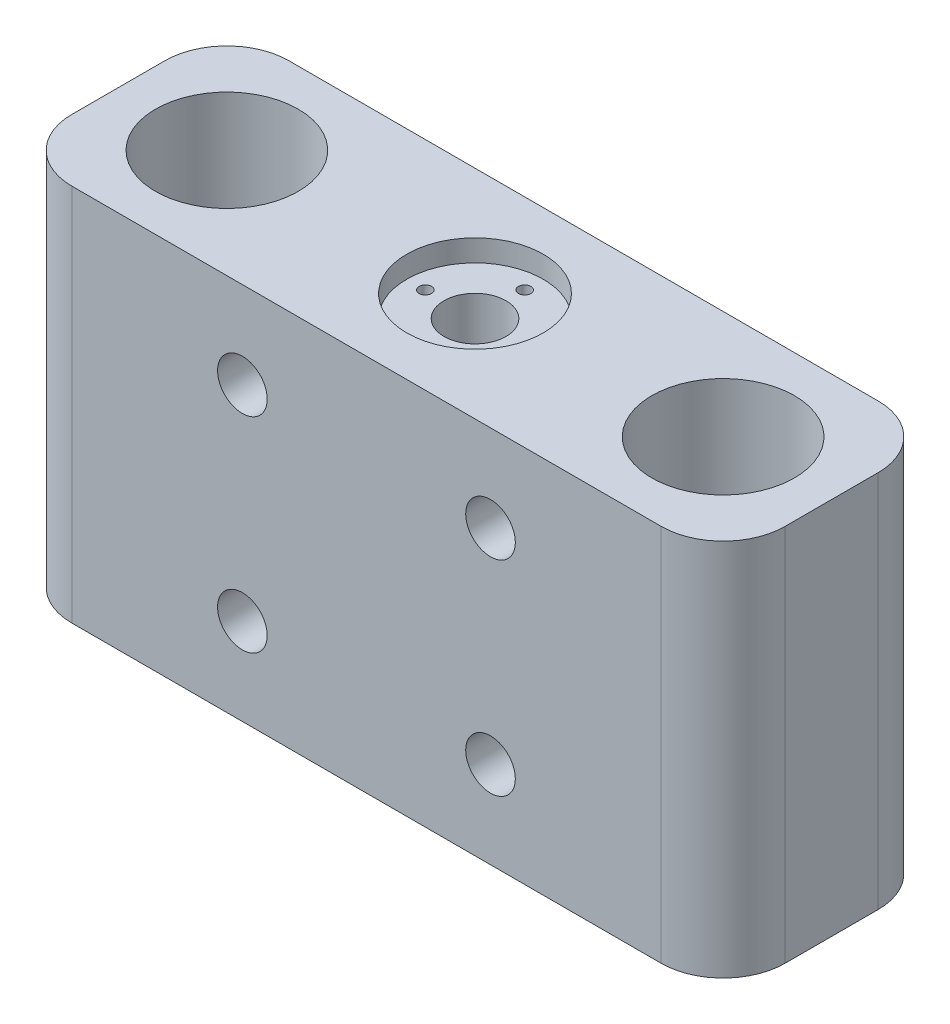
from build123d import *

# Parameters (mm, degrees)
SKETCH1_R           = 11.5
SKETCH1_R_2         = 5
BOSS_EXTRUDE1_DEPTH = 61
SKETCH2_R           = 11
SKETCH2_R_2         = 1
CUT_EXTRUDE1_DEPTH  = 3.5
SKETCH2_2_R         = 1
CUT_EXTRUDE2_DEPTH  = 13.5
SKETCH4_R           = 4
CUT_EXTRUDE3_DEPTH  = 135.799851632
CUT_EXTRUDE4_START  = -25
SKETCH4_3_R         = 4
CUT_EXTRUDE4_DEPTH  = 10


with BuildPart() as part:
    # Sketch1 → Boss-Extrude1 (new body)
    with BuildSketch(Plane(origin=(0, 0, 0), x_dir=(1, 0, 0), z_dir=(0, 1, 0))):
        with BuildLine():
            Line((10, 0), (105, 0))
            ThreePointArc((105, 0), (112.071067812, 2.928932188), (115, 10))
            Line((115, 10), (115, 25))
            ThreePointArc((115, 25), (112.071067812, 32.071067812), (105, 35))
            Line((105, 35), (10, 35))
            ThreePointArc((10, 35), (2.928932188, 32.071067812), (0, 25))
            Line((0, 25), (0, 10))
            ThreePointArc((0, 10), (2.928932188, 2.928932188), (10, 0))
        make_face()
        with Locations(Location((17.5, 17.5, 0), (0, 0, 90))):
            Circle(SKETCH1_R, mode=Mode.SUBTRACT)
        with Locations(Location((57.5, 17.5, 0), (0, 0, 90))):
            Circle(SKETCH1_R_2, mode=Mode.SUBTRACT)
        with Locations(Location((97.5, 17.5, 0), (0, 0, 90))):
            Circle(SKETCH1_R, mode=Mode.SUBTRACT)
    extrude(amount=BOSS_EXTRUDE1_DEPTH)

    # Sketch2 → Cut-Extrude1 (cut)
    with BuildSketch(Plane(origin=(0, 61, 0), x_dir=(1, 0, 0), z_dir=(0, 1, 0))):
        with Locations(Location((57.5, 17.5, 0), (0, 0, 270))):
            Circle(SKETCH2_R)
        with Locations(Location((57.5, 25.5, 0), (0, 0, 270))):
            Circle(SKETCH2_R_2, mode=Mode.SUBTRACT)
        with Locations(Location((65.5, 17.5, 0), (0, 0, 270))):
            Circle(SKETCH2_R_2, mode=Mode.SUBTRACT)
        with Locations(Location((57.5, 9.5, 0), (0, 0, 270))):
            Circle(SKETCH2_R_2, mode=Mode.SUBTRACT)
        with Locations(Location((49.5, 17.5, 0), (0, 0, 270))):
            Circle(SKETCH2_R_2, mode=Mode.SUBTRACT)
    extrude(amount=-CUT_EXTRUDE1_DEPTH, mode=Mode.SUBTRACT)

    # Sketch2<2> → Cut-Extrude2 (cut)
    with BuildSketch(Plane(origin=(0, 61, 0), x_dir=(1, 0, 0), z_dir=(0, 1, 0))):
        with Locations(Location((57.5, 25.5, 0), (0, 0, 270))):
            Circle(SKETCH2_2_R)
        with Locations(Location((65.5, 17.5, 0), (0, 0, 270))):
            Circle(SKETCH2_2_R)
        with Locations(Location((57.5, 9.5, 0), (0, 0, 270))):
            Circle(SKETCH2_2_R)
        with Locations(Location((49.5, 17.5, 0), (0, 0, 270))):
            Circle(SKETCH2_2_R)
    extrude(amount=-CUT_EXTRUDE2_DEPTH, mode=Mode.SUBTRACT)

    # Sketch4 → Cut-Extrude3 (cut, through all)
    with BuildSketch(Plane.XY):
        with Locations((37.5, 47)):
            Circle(SKETCH4_R)
        with Locations((37.5, 14)):
            Circle(SKETCH4_R)
        with Locations(Location((77.5, 14, 0), (0, 0, 180))):
            Circle(SKETCH4_R)
        with Locations(Location((77.5, 47, 0), (0, 0, 180))):
            Circle(SKETCH4_R)
    extrude(amount=-CUT_EXTRUDE3_DEPTH, mode=Mode.SUBTRACT)

    # Sketch4<3> → Cut-Extrude4 (cut)
    # profile 1 of 4: a face of its own
    with BuildSketch(Plane.XY.offset(CUT_EXTRUDE4_START)):
        Polygon((81.25277675, 20.5), (85.005553499, 14), (81.25277675, 7.5), (73.74722325, 7.5), (69.994446501, 14), (73.74722325, 20.5), align=None)
        with Locations((77.5, 14)):
            Circle(SKETCH4_3_R, mode=Mode.SUBTRACT)
    # profile 2 of 4: a face of its own
    with BuildSketch(Plane.XY.offset(CUT_EXTRUDE4_START)):
        Polygon((29.994446501, 47), (33.74722325, 40.5), (41.25277675, 40.5), (45.005553499, 47), (41.25277675, 53.5), (33.74722325, 53.5), align=None)
        with Locations((37.5, 47)):
            Circle(SKETCH4_3_R, mode=Mode.SUBTRACT)
    # profile 3 of 4: a face of its own
    with BuildSketch(Plane.XY.offset(CUT_EXTRUDE4_START)):
        Polygon((29.994446501, 14), (33.74722325, 7.5), (41.25277675, 7.5), (45.005553499, 14), (41.25277675, 20.5), (33.74722325, 20.5), align=None)
        with Locations((37.5, 14)):
            Circle(SKETCH4_3_R, mode=Mode.SUBTRACT)
    # profile 4 of 4: a face of its own
    with BuildSketch(Plane.XY.offset(CUT_EXTRUDE4_START)):
        Polygon((81.25277675, 53.5), (85.005553499, 47), (81.25277675, 40.5), (73.74722325, 40.5), (69.994446501, 47), (73.74722325, 53.5), align=None)
        with Locations((77.5, 47)):
            Circle(SKETCH4_3_R, mode=Mode.SUBTRACT)
    extrude(amount=-CUT_EXTRUDE4_DEPTH, mode=Mode.SUBTRACT)


solid = part.part
